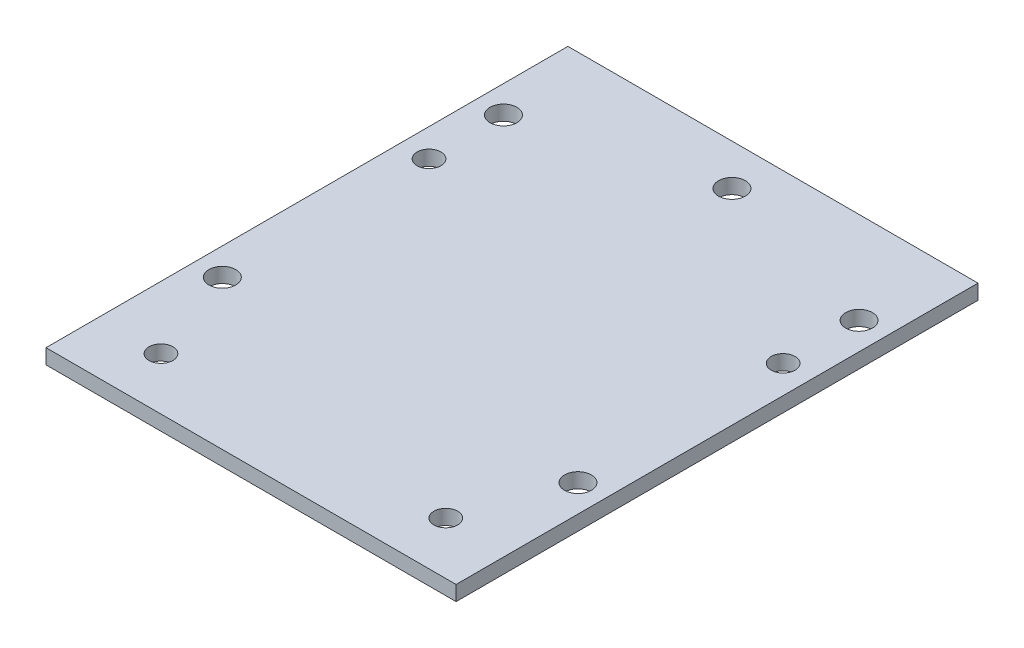
from build123d import *

# Parameters (mm, degrees)
SKETCH1_W           = 55
SKETCH1_H           = 70
SKETCH1_R           = 1.6
SKETCH1_R_2         = 1.8
BOSS_EXTRUDE1_DEPTH = 2


with BuildPart() as part:
    # Sketch1 → Boss-Extrude1 (new body)
    with BuildSketch(Plane(origin=(0, 0, 0), x_dir=(1, 0, 0), z_dir=(0, 1, 0))):
        with Locations((0.494604317, -6.411870504)):
            Rectangle(SKETCH1_W, SKETCH1_H)
        with Locations(Location((19.594604317, -34.394863823, 0), (0, 0, 270))):
            Circle(SKETCH1_R, mode=Mode.SUBTRACT)
        with Locations(Location((-18.605395683, -34.394863823, 0), (0, 0, 270))):
            Circle(SKETCH1_R, mode=Mode.SUBTRACT)
        with Locations(Location((24.244604317, 6.205136177, 0), (0, 0, 270))):
            Circle(SKETCH1_R, mode=Mode.SUBTRACT)
        with Locations(Location((-23.255395683, 6.205136177, 0), (0, 0, 270))):
            Circle(SKETCH1_R, mode=Mode.SUBTRACT)
        with Locations(Location((24.344604317, -21.411870504, 0), (0, 0, 270))):
            Circle(SKETCH1_R_2, mode=Mode.SUBTRACT)
        with Locations(Location((-23.355395683, -21.411870504, 0), (0, 0, 270))):
            Circle(SKETCH1_R_2, mode=Mode.SUBTRACT)
        with Locations(Location((24.344604317, 16.288129496, 0), (0, 0, 270))):
            Circle(SKETCH1_R_2, mode=Mode.SUBTRACT)
        with Locations(Location((-23.355395683, 16.288129496, 0), (0, 0, 270))):
            Circle(SKETCH1_R_2, mode=Mode.SUBTRACT)
        with Locations(Location((0.494604317, 23.086474883, 0), (0, 0, 270))):
            Circle(SKETCH1_R_2, mode=Mode.SUBTRACT)
    extrude(amount=BOSS_EXTRUDE1_DEPTH)


solid = part.part
